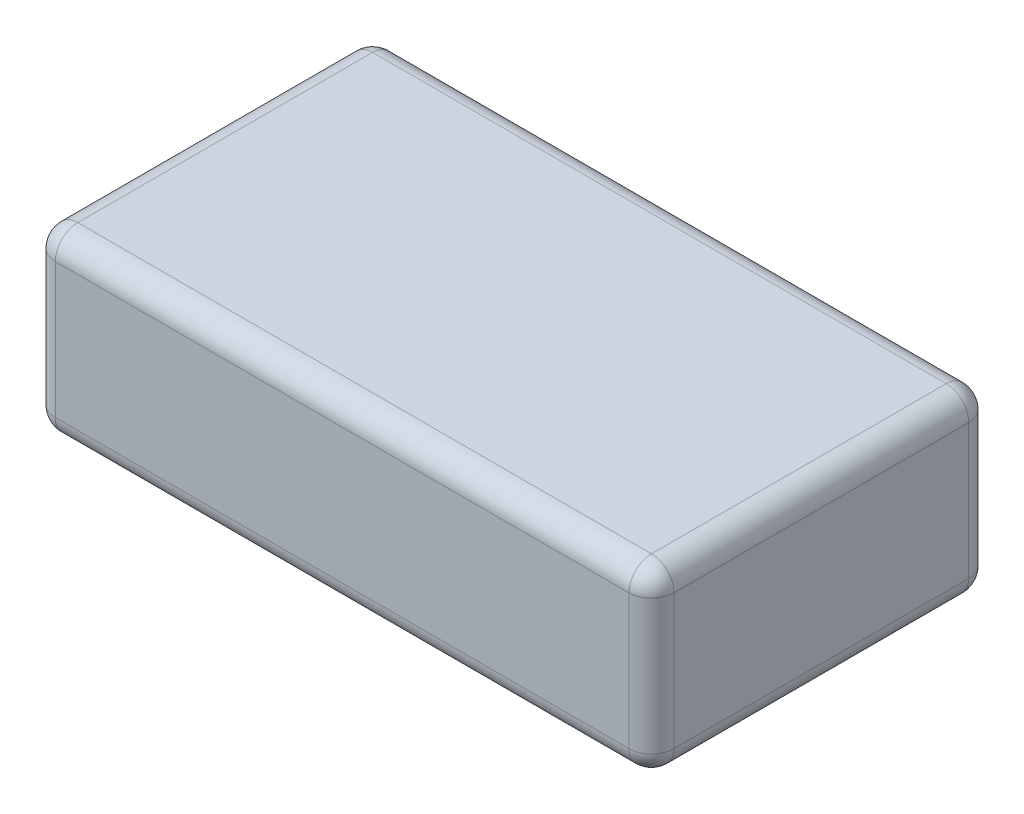
from build123d import *

# Parameters (mm, degrees)
ESBO_O1_W                = 55
ESBO_O1_H                = 30.2
RESSALTO_EXTRUS_O1_DEPTH = 16
FILETE1_R                = 2


with BuildPart() as part:
    # Esboço1 → Ressalto-extrusão1 (new body)
    with BuildSketch(Plane(origin=(0, 0, 0), x_dir=(1, 0, 0), z_dir=(0, 1, 0))):
        Rectangle(ESBO_O1_W, ESBO_O1_H)
    extrude(amount=RESSALTO_EXTRUS_O1_DEPTH)

    # Filete1
    filete1_edges = [part.edges().sort_by_distance(p)[0] for p in [
        (-27.5, 16, 0),
        (0, 16, 15.1),
        (27.5, 16, 0),
        (0, 0, 15.1),
        (-27.5, 0, 0),
        (0, 0, -15.1),
        (27.5, 0, 0),
        (0, 16, -15.1),
        (27.5, 8, 15.1),
        (-27.5, 8, 15.1),
        (-27.5, 8, -15.1),
        (27.5, 8, -15.1),
    ]]
    fillet(filete1_edges, radius=FILETE1_R)


solid = part.part
